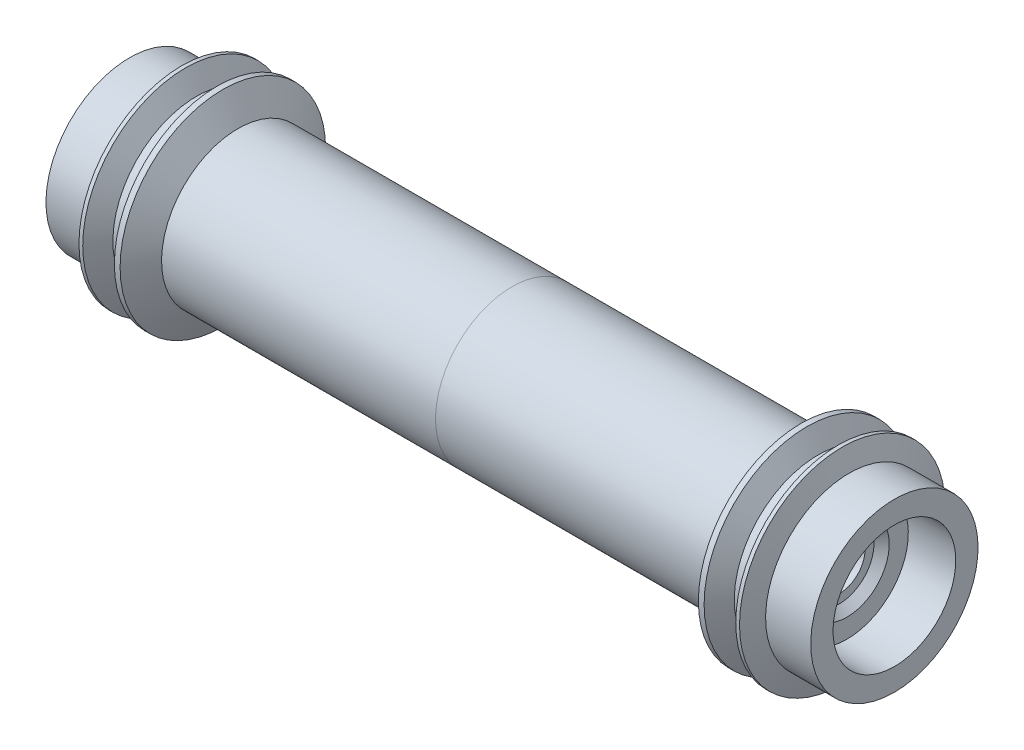
from build123d import *

# Parameters (mm, degrees)
CHAMFER1_SIZE = 0.508


with BuildPart() as part:
    # Sketch2 → Revolve1 (revolve)
    with BuildSketch(Plane.XY, mode=Mode.PRIVATE) as revolve1_sk:
        Polygon((-22.4, 5.55625), (-25.4, 5.55625), (-25.4, 4.075), (-22.25, 4.075), (-22.25, 2.805), (-21.742, 2.297), (-21.742, 1.7145), (-15.575, 1.7145), (-15.575, 0), (-14.1, 0), (-12.5, 1.6), (0, 1.6), (0, 5.08), (-18.197567251, 5.08), (-19.205765158, 6.82625), (-19.586765158, 6.82625), (-20.32, 5.55625), (-20.955, 5.55625), (-21.688234842, 6.82625), (-21.937757802, 6.82625), align=None)
    revolve(revolve1_sk.sketch.rotate(Axis((-25.4, 0, 0), (1, 0, 0)), 180), axis=Axis((-25.4, 0, 0), (1, 0, 0)))


with BuildPart() as body_2:
    # Mirror1: mirrored copy
    add(part.part.mirror(Plane(origin=(0, 0, 0), x_dir=(0, 0, 1), z_dir=(1, 0, 0))))


with BuildPart() as part_1:
    add(part.part)

    # Chamfer1
    chamfer1_edges = [part_1.edges().sort_by_distance(p)[0] for p in [
        (-25.4, 4.075, 0),
    ]]
    chamfer(chamfer1_edges, length=CHAMFER1_SIZE)


solid = Compound([body_2.part, part_1.part])
